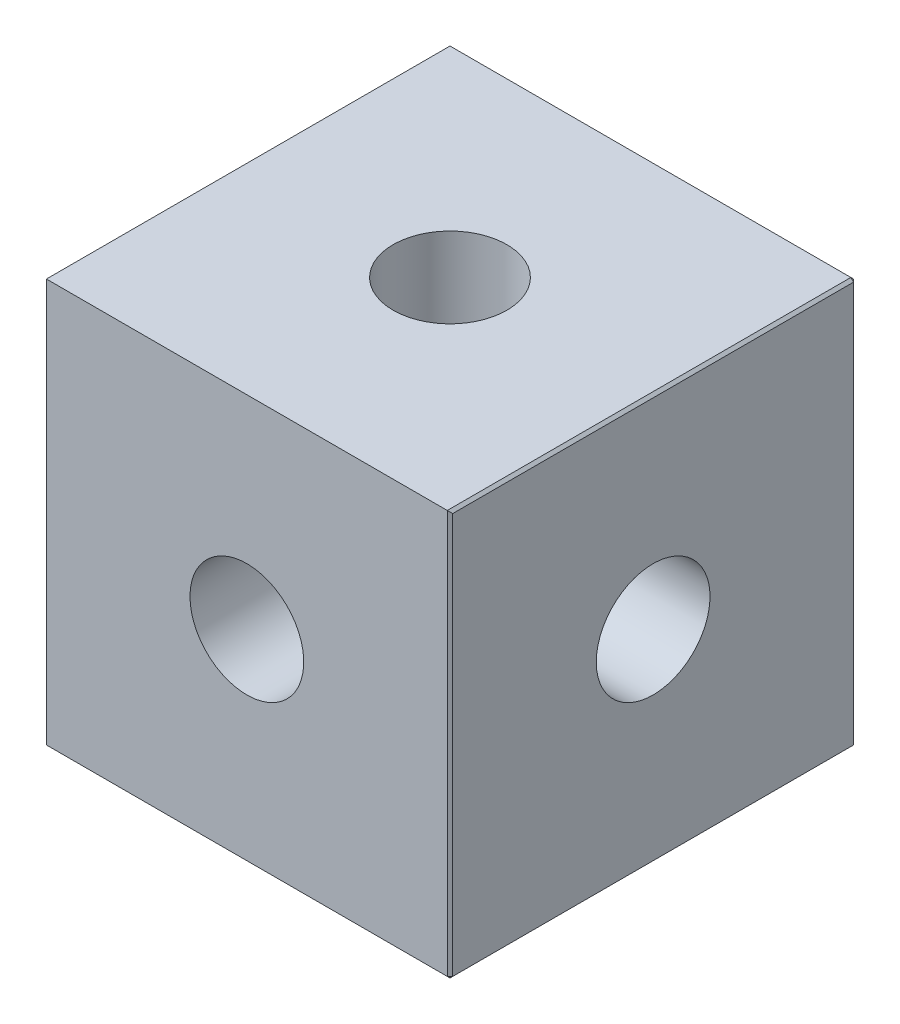
from build123d import *

# Parameters (mm, degrees)
SKETCH_1_W      = 15
SKETCH_1_H      = 15
EXTRUDE_1_DEPTH = 15
M5X0_8_1_D      = 4.2
M5X0_8_2_D      = 4.2
M5X0_8_3_D      = 4.2
CHAMFER_1_SIZE  = 0.1


with BuildPart() as part:
    # 草图1 → 凸台-拉伸1 (new body)
    with BuildSketch(Plane(origin=(0, 0, 0), x_dir=(1, 0, 0), z_dir=(0, 1, 0))):
        Rectangle(SKETCH_1_W, SKETCH_1_H)
    extrude(amount=EXTRUDE_1_DEPTH)

    # M5x0.8 螺纹孔1 (through all)
    with Locations(Plane(origin=(0, 15, 0), x_dir=(1, 0, 0), z_dir=(0, 1, 0))):
        with Locations((0, 0)):
            Hole(M5X0_8_1_D / 2)

    # M5x0.8 螺纹孔2 (through all)
    with Locations(Plane(origin=(0, 0, -7.5), x_dir=(-1, 0, 0), z_dir=(0, 0, -1))):
        with Locations((0, 7.5)):
            Hole(M5X0_8_2_D / 2)

    # M5x0.8 螺纹孔3 (through all)
    with Locations(Plane.ZY.offset(7.5)):
        with Locations((0, 7.5)):
            Hole(M5X0_8_3_D / 2)

    # 倒角1
    chamfer_1_edges = [part.edges().sort_by_distance(p)[0] for p in [
        (-7.5, 15, 0),
        (7.5, 15, 0),
        (0, 0, 7.5),
        (-7.5, 0, 0),
        (0, 0, -7.5),
        (7.5, 0, 0),
        (7.5, 7.5, 7.5),
        (-7.5, 7.5, 7.5),
        (-7.5, 7.5, -7.5),
        (7.5, 7.5, -7.5),
        (0, 15, -7.5),
    ]]
    chamfer(chamfer_1_edges, length=CHAMFER_1_SIZE)


solid = part.part
